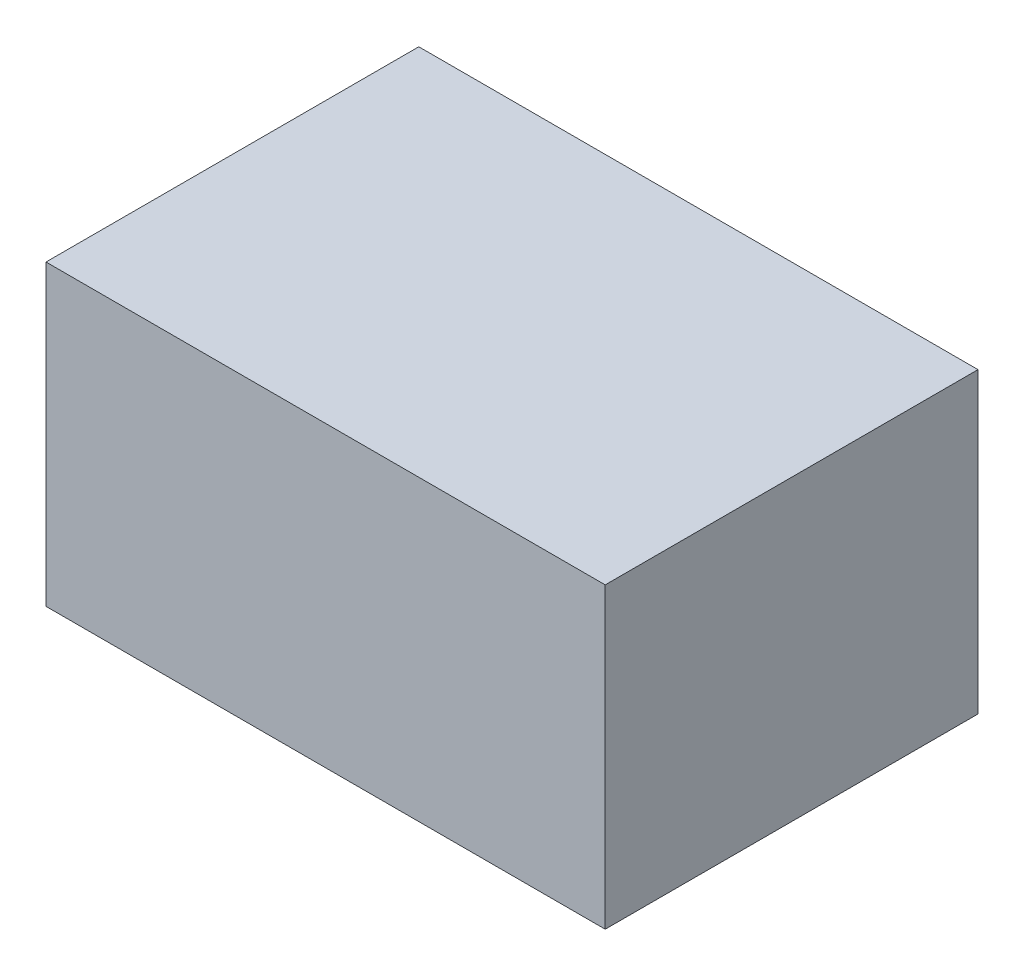
from build123d import *

# Parameters (mm, degrees)
SKETCH_1_W      = 150
SKETCH_1_H      = 100
EXTRUDE_1_DEPTH = 80


with BuildPart() as part:
    # 草图1 → 凸台-拉伸1 (new body)
    with BuildSketch(Plane(origin=(0, 0, 0), x_dir=(1, 0, 0), z_dir=(0, 1, 0))):
        Rectangle(SKETCH_1_W, SKETCH_1_H)
    extrude(amount=EXTRUDE_1_DEPTH)


solid = part.part
